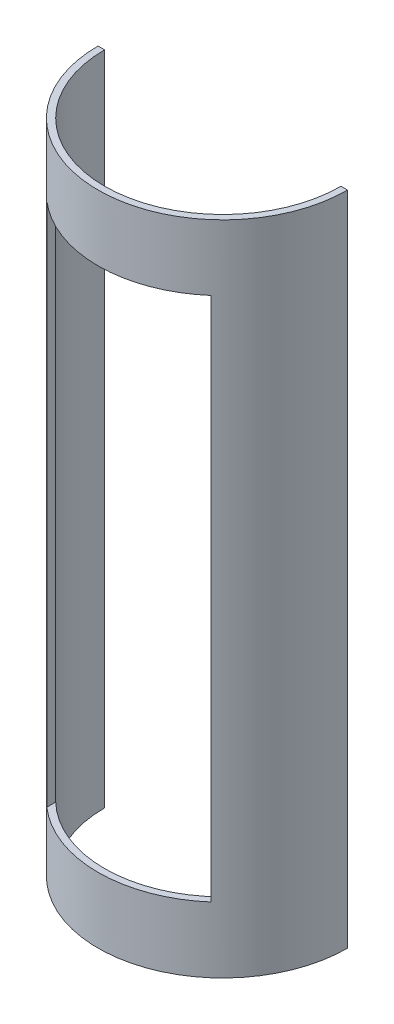
from build123d import *

# Parameters (mm, degrees)
BOSS_EXTRUDE1_DEPTH     = 50
SHELL1_T                = -1
CUT_EXTRUDE1_DEPTH      = 57.762663785
CUT_EXTRUDE1_DEPTH_BACK = 57.762663785
SKETCH2_W               = 25
SKETCH2_H               = 80


with BuildPart() as part:
    # Sketch1 → Boss-Extrude1 (new, symmetric)
    with BuildSketch(Plane(origin=(0, 0, 0), x_dir=(1, 0, 0), z_dir=(0, 1, 0))):
        with BuildLine():
            Line((19, 0), (-19, 0))
            ThreePointArc((-19, 0), (0, -19), (19, 0))
        make_face()
    extrude(amount=BOSS_EXTRUDE1_DEPTH, both=True)

    # Shell1
    shell1_openings = [part.faces().sort_by_distance(p)[0] for p in [
        (0, 50, 8.06385045),
        (0, -50, 8.06385045),
        (0, 0, 0),
    ]]
    offset(amount=SHELL1_T, openings=shell1_openings)

    # Sketch2 → Cut-Extrude1 (cut, two sides: drawn at the far end of the back side and taken through both)
    with BuildSketch(Plane.XY.offset(-CUT_EXTRUDE1_DEPTH_BACK)):
        Rectangle(SKETCH2_W, SKETCH2_H)
    extrude(amount=CUT_EXTRUDE1_DEPTH + CUT_EXTRUDE1_DEPTH_BACK, mode=Mode.SUBTRACT)


solid = part.part
